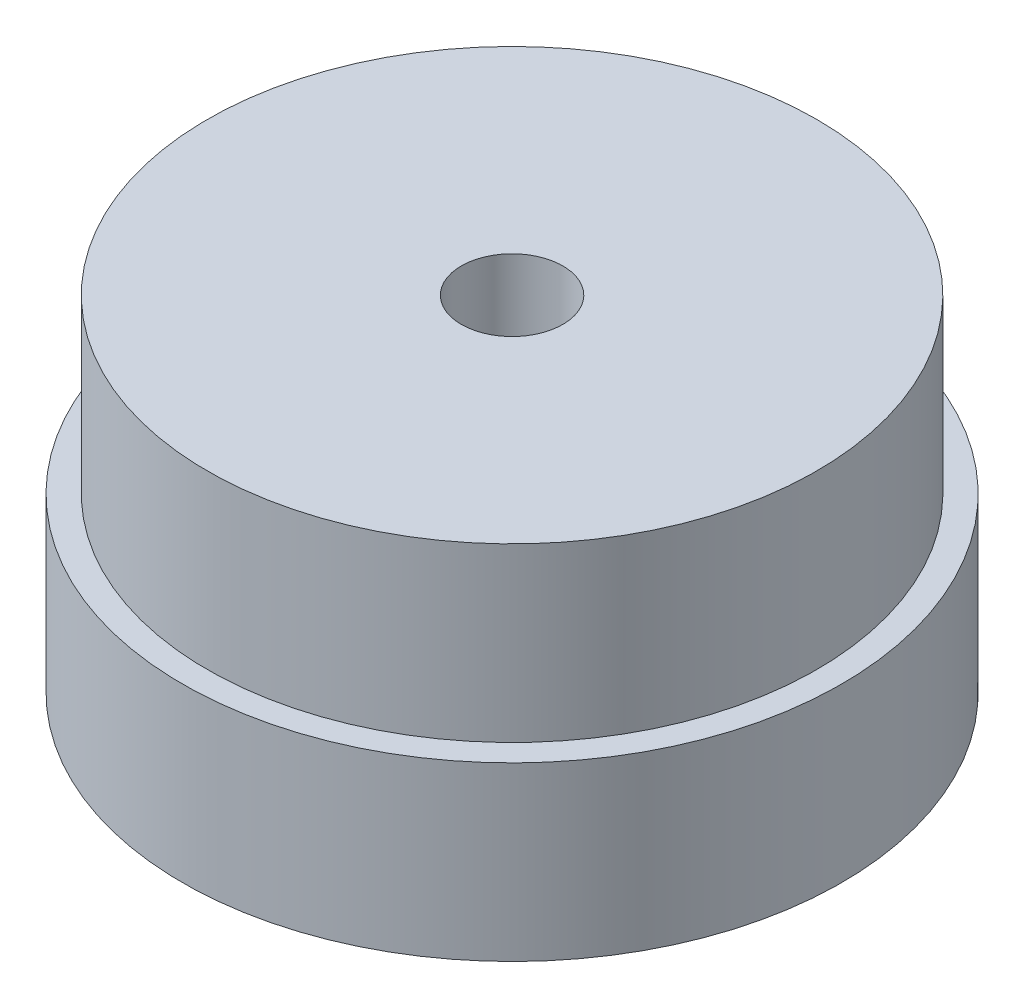
from build123d import *

# Parameters (mm, degrees)
SKETCH2_R          = 2.54
CUT_EXTRUDE1_DEPTH = 30.003356194
SHELL2_T           = -0.254


with BuildPart() as part:
    # Sketch1 → Revolve1 (revolve)
    with BuildSketch(Plane.XY, mode=Mode.PRIVATE) as revolve1_sk:
        Polygon((0, 0), (0, 17.224827156), (15.25, 17.224827156), (15.25, 8.612413578), (16.5, 8.612413578), (16.5, 0), align=None)
    revolve(revolve1_sk.sketch.rotate(Axis((0, 0, 0), (0, 1, 0)), 90), axis=Axis((0, 0, 0), (0, 1, 0)))

    # Sketch2 → Cut-Extrude1 (cut, through all)
    with BuildSketch(Plane(origin=(0, 17.224827156, 0), x_dir=(1, 0, 0), z_dir=(0, 1, 0))):
        with Locations(Location((0, 0, 0), (0, 0, 270))):
            Circle(SKETCH2_R)
    extrude(amount=-CUT_EXTRUDE1_DEPTH, mode=Mode.SUBTRACT)

    # Shell2
    shell2_openings = [part.faces().sort_by_distance(p)[0] for p in [
        (0, 0, 16.033309524),
    ]]
    offset(amount=SHELL2_T, openings=shell2_openings, kind=Kind.INTERSECTION)


solid = part.part
